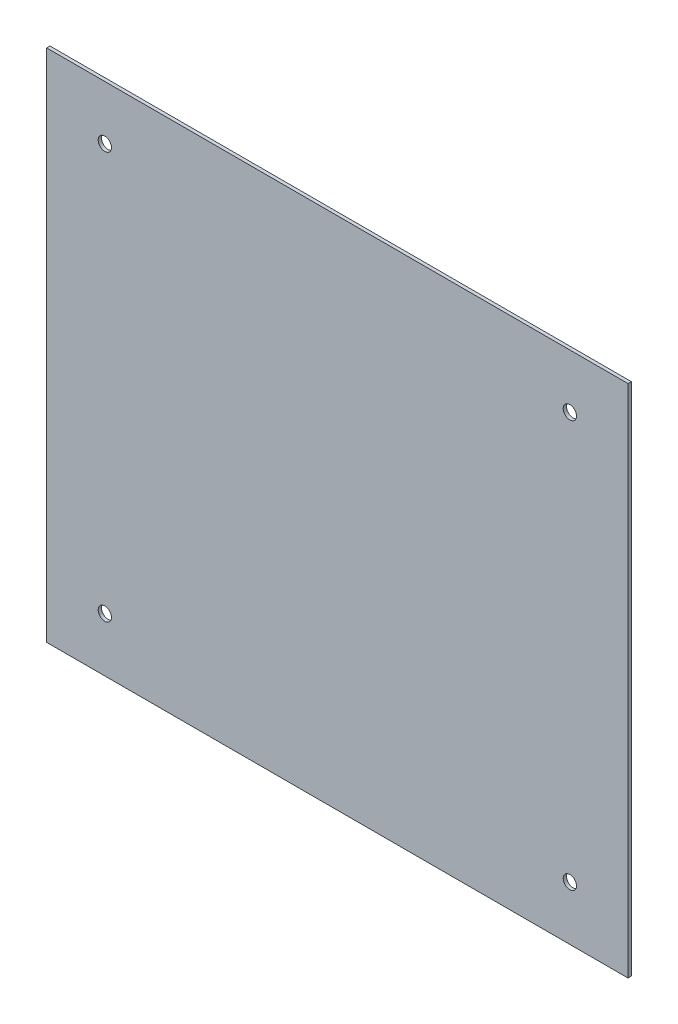
from build123d import *

# Parameters (mm, degrees)
SKETCH1_W           = 350
SKETCH1_H           = 310
BOSS_EXTRUDE1_DEPTH = 2
SKETCH2_R           = 4
CUT_EXTRUDE1_DEPTH  = 234.781949688


with BuildPart() as part:
    # Sketch1 → Boss-Extrude1 (new body)
    with BuildSketch(Plane.XY):
        Rectangle(SKETCH1_W, SKETCH1_H)
    extrude(amount=BOSS_EXTRUDE1_DEPTH)

    # Sketch2 → Cut-Extrude1 (cut, through all)
    with BuildSketch(Plane.XY.offset(2)):
        with Locations((-140, 122.5)):
            Circle(SKETCH2_R)
        with Locations(Location((-140, -122.5, 0), (0, 0, 180))):
            Circle(SKETCH2_R)
        with Locations((140, -122.5)):
            Circle(SKETCH2_R)
        with Locations(Location((140, 122.5, 0), (0, 0, 180))):
            Circle(SKETCH2_R)
    extrude(amount=-CUT_EXTRUDE1_DEPTH, mode=Mode.SUBTRACT)


solid = part.part
